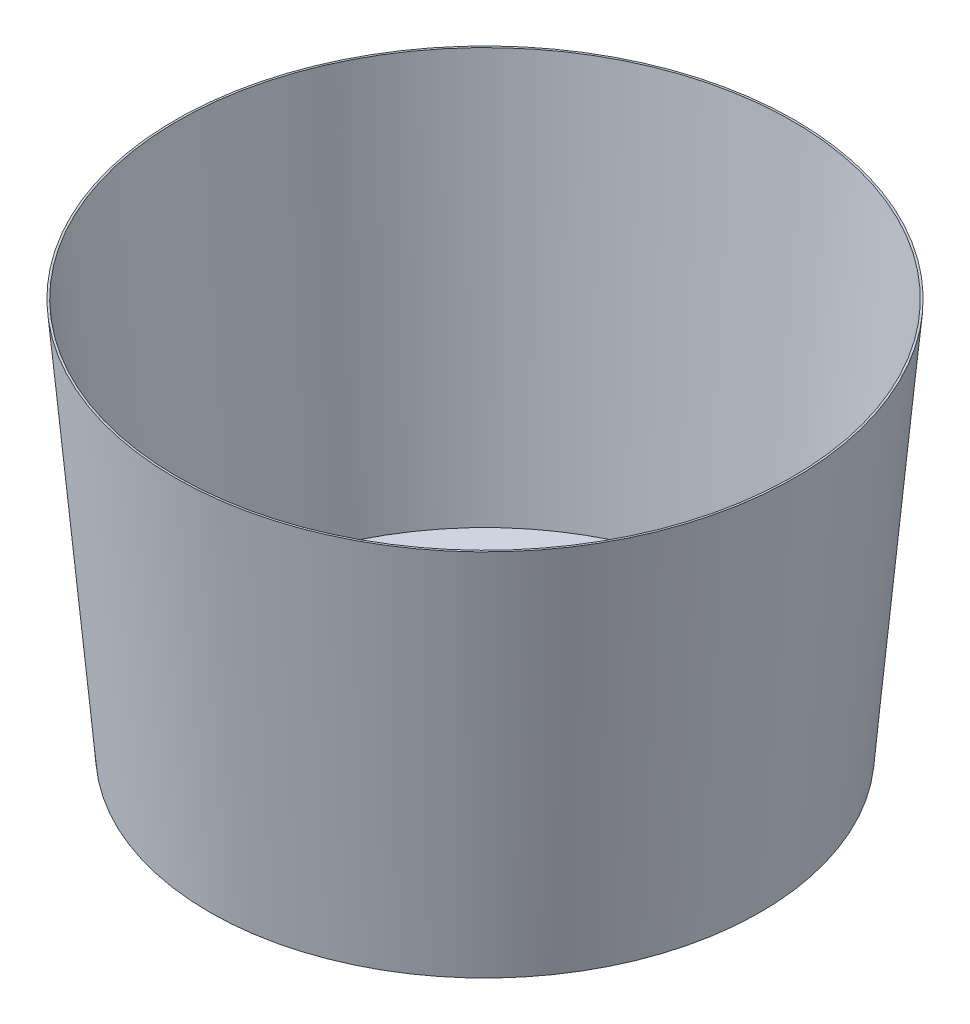
from build123d import *

# Parameters (mm, degrees)
SKETCH1_R           = 35.56
BOSS_EXTRUDE1_DEPTH = 50.8
BOSS_EXTRUDE1_DRAFT = -5
SKETCH2_R           = 39.750424107
CUT_EXTRUDE1_DEPTH  = 50.546
CUT_EXTRUDE1_DRAFT  = -5


with BuildPart() as part:
    # Sketch1 → Boss-Extrude1 (with draft: the straight prism first)
    with BuildSketch(Plane(origin=(0, 0, 0), x_dir=(1, 0, 0), z_dir=(0, 1, 0))):
        Circle(SKETCH1_R)
    extrude(amount=BOSS_EXTRUDE1_DEPTH)
    # Boss-Extrude1: the draft: its side faces are tilted about the plane it starts from
    boss_extrude1_sides = [part.faces().sort_by_distance(p)[0] for p in [
        (-35.56, 25.4, 0),
    ]]
    draft(boss_extrude1_sides, Plane(origin=(0, 0, 0), x_dir=(1, 0, 0), z_dir=(0, 1, 0)), BOSS_EXTRUDE1_DRAFT)


with BuildPart() as cut_extrude1_tool:
    # Sketch2 → Cut-Extrude1 (with draft: the straight prism first)
    with BuildSketch(Plane(origin=(0, 50.8, 0), x_dir=(1, 0, 0), z_dir=(0, 1, 0))):
        Circle(SKETCH2_R)
    extrude(amount=-CUT_EXTRUDE1_DEPTH)
    # Cut-Extrude1: the draft: its side faces are tilted about the plane it starts from
    cut_extrude1_sides = [cut_extrude1_tool.faces().sort_by_distance(p)[0] for p in [
        (-39.750424107, 25.527, 0),
    ]]
    draft(cut_extrude1_sides, Plane(origin=(0, 50.8, 0), x_dir=(1, 0, 0), z_dir=(0, 1, 0)), CUT_EXTRUDE1_DRAFT)


with BuildPart() as part_1:
    add(part.part)

    # Cut-Extrude1: cut by cut_extrude1_tool
    add(cut_extrude1_tool.part, mode=Mode.SUBTRACT)


solid = part_1.part
